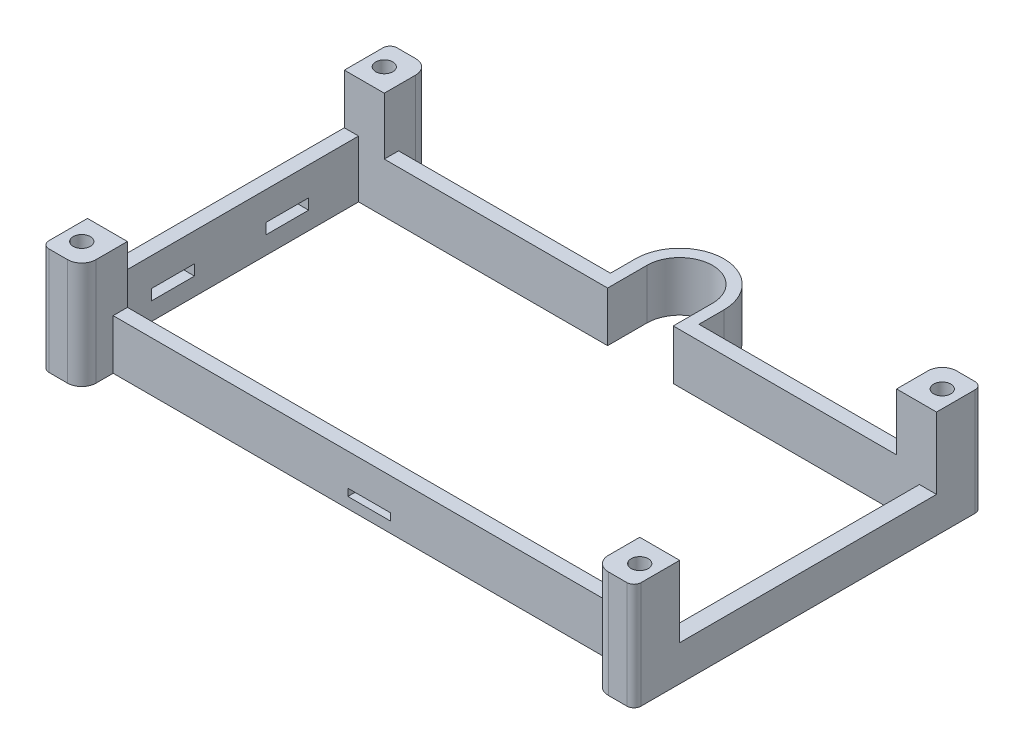
from build123d import *

# Parameters (mm, degrees)
SKETCH1_R               = 1.2
BOSS_EXTRUDE1_DEPTH     = 15
SKETCH3_W               = 15
SKETCH3_H               = 36
BOSS_EXTRUDE3_DEPTH     = 1.5
BOSS_EXTRUDE4_DEPTH     = 19.5
SKETCH6_R               = 1.2
BOSS_EXTRUDE5_DEPTH     = 15
SKETCH7_W               = 2
SKETCH7_H               = 36
BOSS_EXTRUDE6_DEPTH     = 8
SKETCH8_W               = 6
SKETCH8_H               = 1
CUT_EXTRUDE1_DEPTH      = 5
SKETCH9_W               = 6
SKETCH9_H               = 1.5
CUT_EXTRUDE2_DEPTH      = 5
CUT_EXTRUDE3_DEPTH      = 94.234757467
CUT_EXTRUDE3_DEPTH_BACK = 94.234757467
SKETCH10_W              = 71.8
SKETCH10_H              = 8
SKETCH11_W              = 36
SKETCH11_H              = 10
CUT_EXTRUDE4_DEPTH      = 10
SKETCH12_W              = 15
SKETCH12_H              = 36
CUT_EXTRUDE5_DEPTH      = 10


with BuildPart() as part:
    # Sketch1 → Boss-Extrude1 (new body)
    with BuildSketch(Plane(origin=(0, 0, 0), x_dir=(1, 0, 0), z_dir=(0, 1, 0))):
        with BuildLine():
            Line((2.4, -23.4), (2.4, 23.4))
            ThreePointArc((2.4, 23.4), (2.107106781, 24.107106781), (1.4, 24.4))
            Line((1.4, 24.4), (-1.2, 24.4))
            ThreePointArc((-1.2, 24.4), (-2.614213562, 23.814213562), (-3.2, 22.4))
            Line((-3.2, 22.4), (-3.2, 20))
            Line((-3.2, 20), (-15, 20))
            Line((-15, 20), (-15, 18))
            Line((-15, 18), (0, 18))
            Line((0, 18), (0, -18))
            Line((0, -18), (-15, -18))
            Line((-15, -18), (-15, -20))
            Line((-15, -20), (-3.2, -20))
            Line((-3.2, -20), (-3.2, -22.4))
            ThreePointArc((-3.2, -22.4), (-2.614213562, -23.814213562), (-1.2, -24.4))
            Line((-1.2, -24.4), (1.4, -24.4))
            ThreePointArc((1.4, -24.4), (2.107106781, -24.107106781), (2.4, -23.4))
        make_face()
        with Locations(Location((0, -21.2, 0), (0, 0, 270))):
            Circle(SKETCH1_R, mode=Mode.SUBTRACT)
        with Locations(Location((0, 21.2, 0), (0, 0, 90))):
            Circle(SKETCH1_R, mode=Mode.SUBTRACT)
    extrude(amount=BOSS_EXTRUDE1_DEPTH)

    # Sketch3 → Boss-Extrude3 (add)
    with BuildSketch(Plane(origin=(0, 0, 0), x_dir=(1, 0, 0), z_dir=(0, 1, 0))):
        with Locations((-7.5, 0)):
            Rectangle(SKETCH3_W, SKETCH3_H)
    extrude(amount=BOSS_EXTRUDE3_DEPTH)

    # Sketch4 → Boss-Extrude4 (add)
    with BuildSketch(Plane.ZY.offset(15)):
        Polygon((-18, 1.5), (-18, 0), (-20, 0), (-20, 15), (-18, 15), align=None)
    extrude(amount=BOSS_EXTRUDE4_DEPTH)

    # Sketch6 → Boss-Extrude5 (add)
    # profile 1 of 2: a face of its own
    with BuildSketch(Plane(origin=(0, 15, 0), x_dir=(1, 0, 0), z_dir=(0, 1, 0))):
        with BuildLine():
            Line((-45.3, 20), (-45.3, 23.5))
            ThreePointArc((-45.3, 23.5), (-39.1, 29.7), (-32.9, 23.5))
            Line((-32.9, 23.5), (-32.9, 20))
            Line((-32.9, 20), (-34.5, 20))
            Line((-34.5, 20), (-34.5, 23.5))
            ThreePointArc((-34.5, 23.5), (-39.1, 28.1), (-43.7, 23.5))
            Line((-43.7, 23.5), (-43.7, 20))
            Line((-43.7, 20), (-43.7, 18))
            Line((-43.7, 18), (-80.6, 18))
            Line((-80.6, 18), (-80.6, 23.4))
            ThreePointArc((-80.6, 23.4), (-80.307106781, 24.107106781), (-79.6, 24.4))
            Line((-79.6, 24.4), (-77, 24.4))
            ThreePointArc((-77, 24.4), (-75.585786438, 23.814213562), (-75, 22.4))
            Line((-75, 22.4), (-75, 20))
            Line((-75, 20), (-45.3, 20))
        make_face()
        with Locations(Location((-78.2, 21.2, 0), (0, 0, 270))):
            Circle(SKETCH6_R, mode=Mode.SUBTRACT)
    # profile 2 of 2: a face of its own
    with BuildSketch(Plane(origin=(0, 15, 0), x_dir=(1, 0, 0), z_dir=(0, 1, 0))):
        with BuildLine():
            Line((-80.6, -18), (-15, -18))
            Line((-15, -18), (-15, -20))
            Line((-15, -20), (-75, -20))
            Line((-75, -20), (-75, -22.4))
            ThreePointArc((-75, -22.4), (-75.585786438, -23.814213562), (-77, -24.4))
            Line((-77, -24.4), (-79.6, -24.4))
            ThreePointArc((-79.6, -24.4), (-80.307106781, -24.107106781), (-80.6, -23.4))
            Line((-80.6, -23.4), (-80.6, -18))
        make_face()
        with Locations(Location((-78.2, -21.2, 0), (0, 0, 90))):
            Circle(SKETCH6_R, mode=Mode.SUBTRACT)
    extrude(amount=-BOSS_EXTRUDE5_DEPTH)

    # Sketch7 → Boss-Extrude6 (add)
    with BuildSketch(Plane.XZ):
        with Locations((-79.6, 0)):
            Rectangle(SKETCH7_W, SKETCH7_H)
    extrude(amount=-BOSS_EXTRUDE6_DEPTH)

    # Sketch8 → Cut-Extrude1 (cut)
    with BuildSketch(Plane(origin=(0, 0, 18), x_dir=(-1, 0, 0), z_dir=(0, 0, -1))):
        with Locations((39.1, 2)):
            Rectangle(SKETCH8_W, SKETCH8_H)
    extrude(amount=-CUT_EXTRUDE1_DEPTH, mode=Mode.SUBTRACT)

    # Sketch9 → Cut-Extrude2 (cut)
    with BuildSketch(Plane(origin=(-78.6, 0, 0), x_dir=(0, 0, -1), z_dir=(1, 0, 0))):
        with Locations((8, 3.25)):
            Rectangle(SKETCH9_W, SKETCH9_H)
        with Locations((-8, 3.25)):
            Rectangle(SKETCH9_W, SKETCH9_H)
    extrude(amount=-CUT_EXTRUDE2_DEPTH, mode=Mode.SUBTRACT)

    # Sketch10 → Cut-Extrude3 (cut, two sides: drawn at the far end of the back side and taken through both)
    with BuildSketch(Plane(origin=(0, 0, -20), x_dir=(-1, 0, 0), z_dir=(0, 0, -1)).offset(-CUT_EXTRUDE3_DEPTH_BACK)):
        with Locations((39.1, 11)):
            Rectangle(SKETCH10_W, SKETCH10_H)
    extrude(amount=CUT_EXTRUDE3_DEPTH + CUT_EXTRUDE3_DEPTH_BACK, mode=Mode.SUBTRACT)

    # Sketch11 → Cut-Extrude4 (cut)
    with BuildSketch(Plane(origin=(2.4, 0, 0), x_dir=(0, 0, -1), z_dir=(1, 0, 0))):
        with Locations((0, 10)):
            Rectangle(SKETCH11_W, SKETCH11_H)
    extrude(amount=-CUT_EXTRUDE4_DEPTH, mode=Mode.SUBTRACT)

    # Sketch12 → Cut-Extrude5 (cut)
    with BuildSketch(Plane.XZ):
        with Locations((-7.5, 0)):
            Rectangle(SKETCH12_W, SKETCH12_H)
    extrude(amount=-CUT_EXTRUDE5_DEPTH, mode=Mode.SUBTRACT)


solid = part.part
